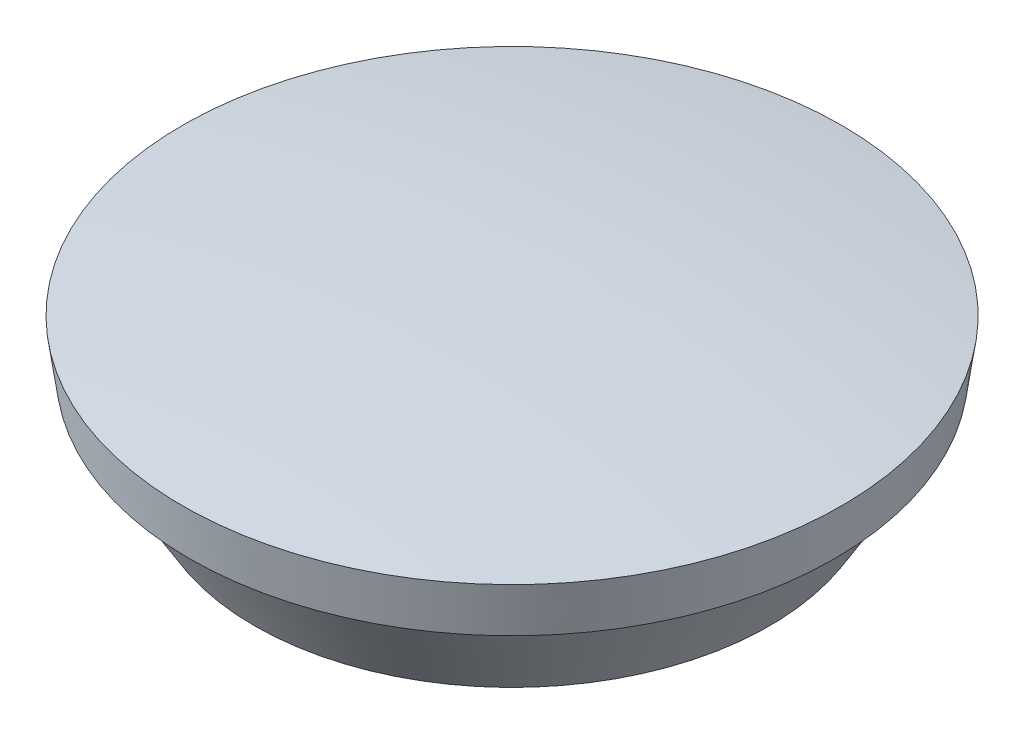
from build123d import *


with BuildPart() as part:
    # Sketch11 → Revolve8 (revolve)
    with BuildSketch(Plane(origin=(0, 0, 0), x_dir=(0, 0, -1), z_dir=(1, 0, 0))):
        with BuildLine():
            Line((46.181267187, 321.561079724), (44.775299462, 321.561079724))
            Line((44.775299462, 321.561079724), (36.878266465, 308.57699063))
            ThreePointArc((36.878266465, 308.57699063), (20.04884282, 320.137504134), (0, 324))
            Line((0, 324), (0, 332))
            ThreePointArc((0, 332), (23.658255601, 331.155985816), (47.196222627, 328.62823459))
            Line((47.196222627, 328.62823459), (46.181267187, 321.561079724))
        make_face()
    revolve(axis=Axis((0, 5, 0), (0, 1, 0)))


solid = part.part
